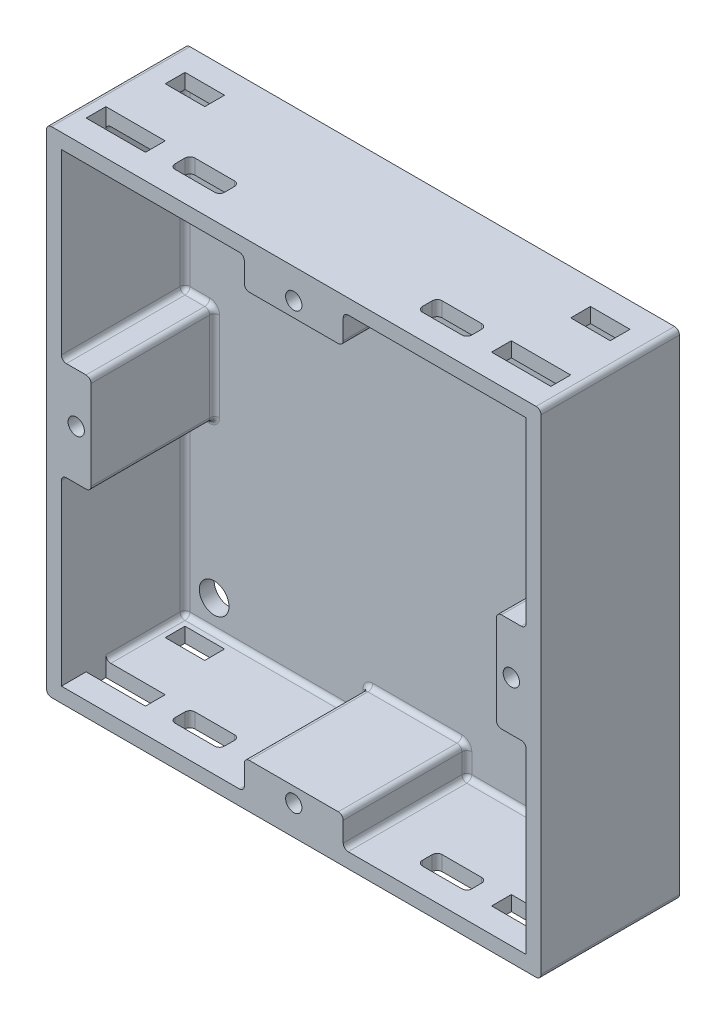
from build123d import *

# Parameters (mm, degrees)
SKETCH1_W                 = 100
SKETCH1_H                 = 100
BOSS_EXTRUDE1_DEPTH       = 3
SKETCH2_W                 = 100
SKETCH2_H                 = 100
SKETCH2_W_2               = 94
SKETCH2_H_2               = 94
BOSS_EXTRUDE2_DEPTH       = 25
SKETCH5_R                 = 3
CUT_EXTRUDE1_DEPTH        = 146.107718609
SKETCH6_W                 = 12
SKETCH6_H                 = 4
SKETCH6_W_2               = 8
CUT_EXTRUDE3_DEPTH        = 145.166570328
SKETCH7_W                 = 6
SKETCH7_H                 = 20
SKETCH7_W_2               = 20
SKETCH7_H_2               = 6
BOSS_EXTRUDE4_DEPTH       = 25
M4X0_7_TAPPED_HOLE1_D     = 3.3
M4X0_7_TAPPED_HOLE1_DEPTH = 20
M4X0_7_TAPPED_HOLE1_TIP   = 0.991420021
FILLET1_R                 = 1
FILLET2_R                 = 1
FILLET3_R                 = 1
FILLET4_R                 = 1
FILLET5_R                 = 1
FILLET6_R                 = 1
FILLET7_R                 = 1
FILLET8_R                 = 1
FILLET9_R                 = 1
FILLET10_R                = 1
FILLET11_R                = 1
FILLET12_R                = 1
FILLET22_R                = 1
FILLET23_R                = 1
FILLET24_R                = 1
FILLET25_R                = 1
FILLET26_R                = 1
FILLET27_R                = 1
FILLET28_R                = 1
FILLET29_R                = 1
FILLET30_R                = 1
FILLET31_R                = 1
FILLET32_R                = 1
FILLET33_R                = 1
CUT_EXTRUDE5_DEPTH        = 145.166570328


with BuildPart() as part:
    # Sketch1 → Boss-Extrude1 (new body)
    with BuildSketch(Plane.XY):
        with Locations((50, 50)):
            Rectangle(SKETCH1_W, SKETCH1_H)
    extrude(amount=BOSS_EXTRUDE1_DEPTH)

    # Sketch2 → Boss-Extrude2 (add)
    with BuildSketch(Plane.XY.offset(3)):
        with Locations((50, 50)):
            Rectangle(SKETCH2_W, SKETCH2_H)
        with Locations((50, 50)):
            Rectangle(SKETCH2_W_2, SKETCH2_H_2, mode=Mode.SUBTRACT)
    extrude(amount=BOSS_EXTRUDE2_DEPTH)

    # Sketch5 → Cut-Extrude1 (cut, through all)
    with BuildSketch(Plane.XY.offset(32.5)):
        with Locations((8.9, 8.9)):
            Circle(SKETCH5_R)
        with Locations((8.9, 91.1)):
            Circle(SKETCH5_R)
        with Locations((91.1, 91.1)):
            Circle(SKETCH5_R)
        with Locations((91.1, 8.9)):
            Circle(SKETCH5_R)
    extrude(amount=-CUT_EXTRUDE1_DEPTH, mode=Mode.SUBTRACT)

    # Sketch6 → Cut-Extrude3 (cut, through all)
    with BuildSketch(Plane.XZ):
        with Locations((9, 21)):
            Rectangle(SKETCH6_W, SKETCH6_H)
        with Locations((91, 21)):
            Rectangle(SKETCH6_W, SKETCH6_H)
        with Locations((9, 7)):
            Rectangle(SKETCH6_W_2, SKETCH6_H)
        with Locations((91, 7)):
            Rectangle(SKETCH6_W_2, SKETCH6_H)
    extrude(amount=-CUT_EXTRUDE3_DEPTH, mode=Mode.SUBTRACT)

    # Sketch7 → Boss-Extrude4 (add)
    with BuildSketch(Plane.XY.offset(3)):
        with Locations((6, 50)):
            Rectangle(SKETCH7_W, SKETCH7_H)
        with Locations((50, 94)):
            Rectangle(SKETCH7_W_2, SKETCH7_H_2)
        with Locations((94, 50)):
            Rectangle(SKETCH7_W, SKETCH7_H)
        with Locations((50, 6)):
            Rectangle(SKETCH7_W_2, SKETCH7_H_2)
    extrude(amount=BOSS_EXTRUDE4_DEPTH)

    # M4x0.7 Tapped Hole1
    with Locations(Plane.XY.offset(28)):
        with Locations((6, 50), (50, 94), (94, 50), (50, 6)):
            Hole(M4X0_7_TAPPED_HOLE1_D / 2, depth=M4X0_7_TAPPED_HOLE1_DEPTH)
            with Locations((0, 0, -(M4X0_7_TAPPED_HOLE1_DEPTH + M4X0_7_TAPPED_HOLE1_TIP / 2))):  # 118° drill point
                Cone(0, M4X0_7_TAPPED_HOLE1_D / 2, M4X0_7_TAPPED_HOLE1_TIP, mode=Mode.SUBTRACT)

    # Fillet1
    fillet1_edges = [part.edges().sort_by_distance(p)[0] for p in [
        (0, 0, 14),
    ]]
    fillet(fillet1_edges, radius=FILLET1_R)

    # Fillet2
    fillet2_edges = [part.edges().sort_by_distance(p)[0] for p in [
        (100, 0, 14),
    ]]
    fillet(fillet2_edges, radius=FILLET2_R)

    # Fillet3
    fillet3_edges = [part.edges().sort_by_distance(p)[0] for p in [
        (0, 100, 14),
    ]]
    fillet(fillet3_edges, radius=FILLET3_R)

    # Fillet4
    fillet4_edges = [part.edges().sort_by_distance(p)[0] for p in [
        (100, 100, 14),
    ]]
    fillet(fillet4_edges, radius=FILLET4_R)

    # Fillet5
    fillet5_edges = [part.edges().sort_by_distance(p)[0] for p in [
        (40, 3, 15.5),
    ]]
    fillet(fillet5_edges, radius=FILLET5_R)

    # Fillet6
    fillet6_edges = [part.edges().sort_by_distance(p)[0] for p in [
        (60, 3, 15.5),
    ]]
    fillet(fillet6_edges, radius=FILLET6_R)

    # Fillet7
    fillet7_edges = [part.edges().sort_by_distance(p)[0] for p in [
        (97, 40, 15.5),
    ]]
    fillet(fillet7_edges, radius=FILLET7_R)

    # Fillet8
    fillet8_edges = [part.edges().sort_by_distance(p)[0] for p in [
        (97, 60, 15.5),
    ]]
    fillet(fillet8_edges, radius=FILLET8_R)

    # Fillet9
    fillet9_edges = [part.edges().sort_by_distance(p)[0] for p in [
        (3, 60, 15.5),
    ]]
    fillet(fillet9_edges, radius=FILLET9_R)

    # Fillet10
    fillet10_edges = [part.edges().sort_by_distance(p)[0] for p in [
        (3, 40, 15.5),
    ]]
    fillet(fillet10_edges, radius=FILLET10_R)

    # Fillet11
    fillet11_edges = [part.edges().sort_by_distance(p)[0] for p in [
        (40, 97, 15.5),
    ]]
    fillet(fillet11_edges, radius=FILLET11_R)

    # Fillet12
    fillet12_edges = [part.edges().sort_by_distance(p)[0] for p in [
        (60, 97, 15.5),
    ]]
    fillet(fillet12_edges, radius=FILLET12_R)

    # Fillet22
    fillet22_edges = [part.edges().sort_by_distance(p)[0] for p in [
        (60, 9, 15.5),
    ]]
    fillet(fillet22_edges, radius=FILLET22_R)

    # Fillet23
    fillet23_edges = [part.edges().sort_by_distance(p)[0] for p in [
        (40, 9, 15.5),
    ]]
    fillet(fillet23_edges, radius=FILLET23_R)

    # Fillet24
    fillet24_edges = [part.edges().sort_by_distance(p)[0] for p in [
        (91, 60, 15.5),
    ]]
    fillet(fillet24_edges, radius=FILLET24_R)

    # Fillet25
    fillet25_edges = [part.edges().sort_by_distance(p)[0] for p in [
        (91, 40, 15.5),
    ]]
    fillet(fillet25_edges, radius=FILLET25_R)

    # Fillet26
    fillet26_edges = [part.edges().sort_by_distance(p)[0] for p in [
        (9, 60, 15.5),
    ]]
    fillet(fillet26_edges, radius=FILLET26_R)

    # Fillet27
    fillet27_edges = [part.edges().sort_by_distance(p)[0] for p in [
        (9, 40, 15.5),
    ]]
    fillet(fillet27_edges, radius=FILLET27_R)

    # Fillet28
    fillet28_edges = [part.edges().sort_by_distance(p)[0] for p in [
        (60, 91, 15.5),
    ]]
    fillet(fillet28_edges, radius=FILLET28_R)

    # Fillet29
    fillet29_edges = [part.edges().sort_by_distance(p)[0] for p in [
        (40, 91, 15.5),
    ]]
    fillet(fillet29_edges, radius=FILLET29_R)

    # Fillet30
    fillet30_edges = [part.edges().sort_by_distance(p)[0] for p in [
        (21, 3, 3),
        (39.707106781, 3.292893219, 3),
        (60, 6, 3),
        (79, 3, 3),
        (60.292893219, 3.292893219, 3),
        (50, 9, 3),
        (59.707106781, 8.707106781, 3),
        (40, 6, 3),
        (40.292893219, 8.707106781, 3),
    ]]
    fillet(fillet30_edges, radius=FILLET30_R)

    # Fillet31
    fillet31_edges = [part.edges().sort_by_distance(p)[0] for p in [
        (3, 79, 3),
        (3.292893219, 60.292893219, 3),
        (3, 21.5, 3),
        (6, 40, 3),
        (3.292893219, 39.707106781, 3),
        (6, 60, 3),
        (8.707106781, 59.707106781, 3),
        (9, 50, 3),
        (8.707106781, 40.292893219, 3),
        (3, 3.292893219, 3.292893219),
        (3, 3, 11.5),
    ]]
    fillet(fillet31_edges, radius=FILLET31_R)

    # Fillet32
    fillet32_edges = [part.edges().sort_by_distance(p)[0] for p in [
        (79, 97, 3),
        (21.5, 97, 3),
        (40, 94, 3),
        (39.707106781, 96.707106781, 3),
        (60.292893219, 96.707106781, 3),
        (60, 94, 3),
        (59.707106781, 91.292893219, 3),
        (50, 91, 3),
        (40.292893219, 91.292893219, 3),
        (3.292893219, 97, 3.292893219),
        (3, 97, 11.5),
    ]]
    fillet(fillet32_edges, radius=FILLET32_R)

    # Fillet33
    fillet33_edges = [part.edges().sort_by_distance(p)[0] for p in [
        (96.707106781, 39.707106781, 3),
        (97, 78.5, 3),
        (94, 60, 3),
        (96.707106781, 60.292893219, 3),
        (91, 50, 3),
        (91.292893219, 59.707106781, 3),
        (94, 40, 3),
        (91.292893219, 40.292893219, 3),
        (97, 21.5, 3),
        (97, 3.292893219, 3.292893219),
        (97, 97, 11.5),
        (97, 96.707106781, 3.292893219),
        (97, 3, 11.5),
    ]]
    fillet(fillet33_edges, radius=FILLET33_R)

    # Sketch12 → Cut-Extrude5 (cut, through all)
    with BuildSketch(Plane.XZ):
        with BuildLine():
            Line((21, 19), (29, 19))
            ThreePointArc((29, 19), (29.707106781, 19.292893219), (30, 20))
            Line((30, 20), (30, 22))
            ThreePointArc((30, 22), (29.707106781, 22.707106781), (29, 23))
            Line((29, 23), (21, 23))
            ThreePointArc((21, 23), (20.292893219, 22.707106781), (20, 22))
            Line((20, 22), (20, 20))
            ThreePointArc((20, 20), (20.292893219, 19.292893219), (21, 19))
        make_face()
        with BuildLine():
            Line((71, 19), (79, 19))
            ThreePointArc((79, 19), (79.707106781, 19.292893219), (80, 20))
            Line((80, 20), (80, 22))
            ThreePointArc((80, 22), (79.707106781, 22.707106781), (79, 23))
            Line((79, 23), (71, 23))
            ThreePointArc((71, 23), (70.292893219, 22.707106781), (70, 22))
            Line((70, 22), (70, 20))
            ThreePointArc((70, 20), (70.292893219, 19.292893219), (71, 19))
        make_face()
    extrude(amount=-CUT_EXTRUDE5_DEPTH, mode=Mode.SUBTRACT)


solid = part.part
